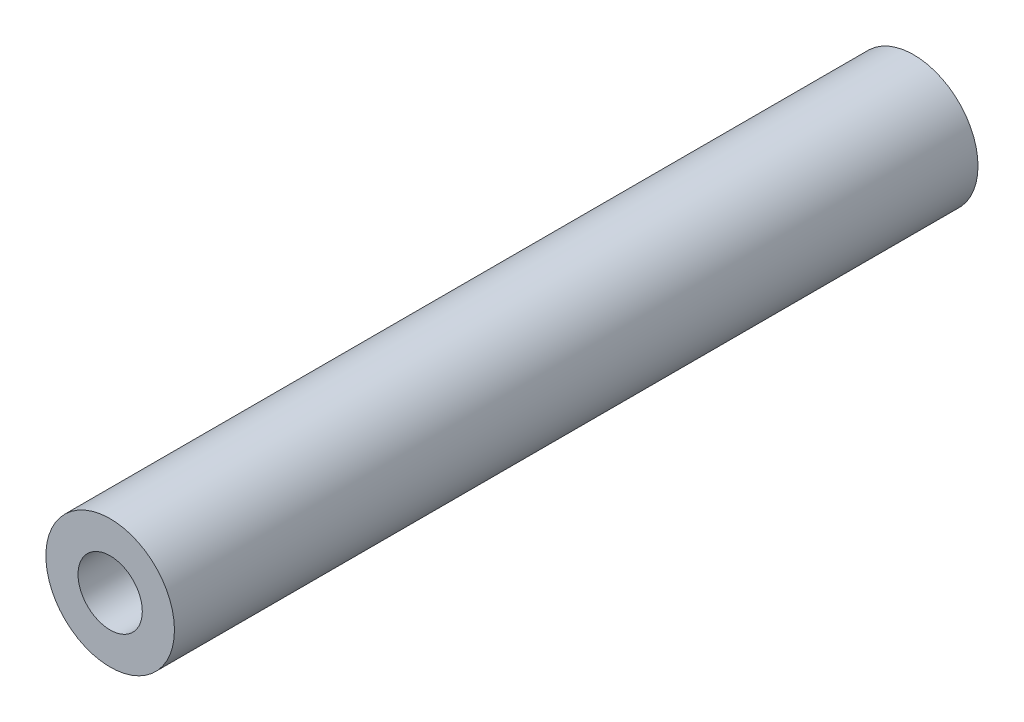
from build123d import *

# Parameters (mm, degrees)
SKETCH_1_R      = 4
SKETCH_1_R_2    = 2
EXTRUDE_1_DEPTH = 25


with BuildPart() as part:
    # 草图1 → 凸台-拉伸1 (new, symmetric)
    with BuildSketch(Plane.XY):
        Circle(SKETCH_1_R)
        Circle(SKETCH_1_R_2, mode=Mode.SUBTRACT)
    extrude(amount=EXTRUDE_1_DEPTH, both=True)


solid = part.part
